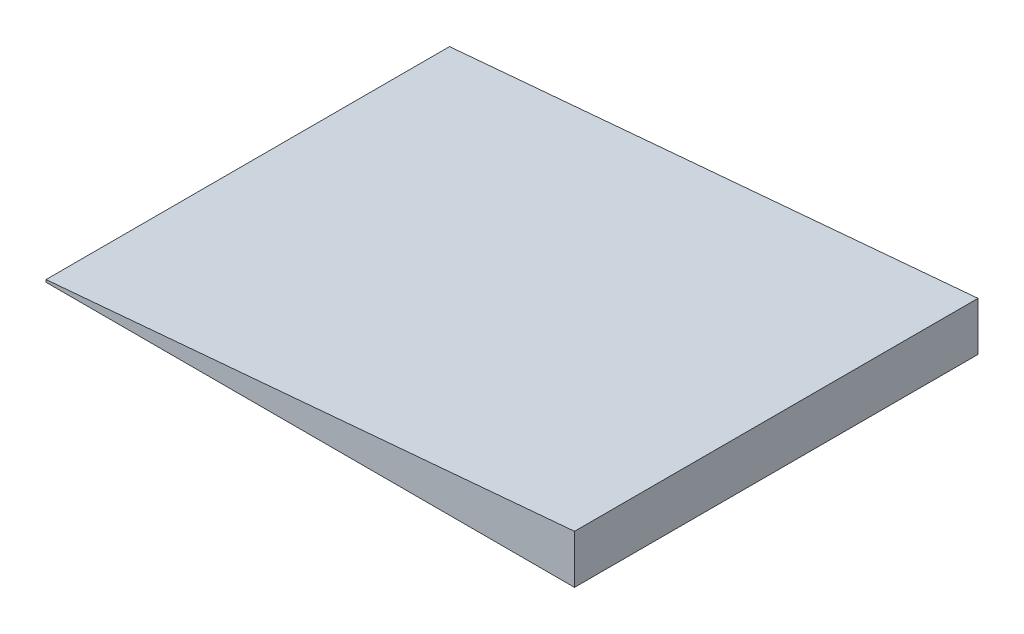
from build123d import *

# Parameters (mm, degrees)
SKETCH1_W           = 163.138716034
SKETCH1_H           = 124.554331204
BOSS_EXTRUDE1_DEPTH = 15
SKETCH4_W           = 143.675268582
SKETCH4_H           = 189.404777192
CUT_EXTRUDE1_DEPTH  = 75


with BuildPart() as part:
    # Sketch1 → Boss-Extrude1 (new body)
    with BuildSketch(Plane(origin=(0, 0, 0), x_dir=(1, 0, 0), z_dir=(0, 1, 0))):
        Rectangle(SKETCH1_W, SKETCH1_H)
    extrude(amount=BOSS_EXTRUDE1_DEPTH)

    # Sketch4 → Cut-Extrude1 (cut)
    with BuildSketch(Plane(origin=(-0.682750416, 7.803872961, 0), x_dir=(0, 0, -1), z_dir=(-0.08715574274765835, 0.9961946980917455, 0))):
        Rectangle(SKETCH4_W, SKETCH4_H)
    extrude(amount=CUT_EXTRUDE1_DEPTH, mode=Mode.SUBTRACT)


solid = part.part
